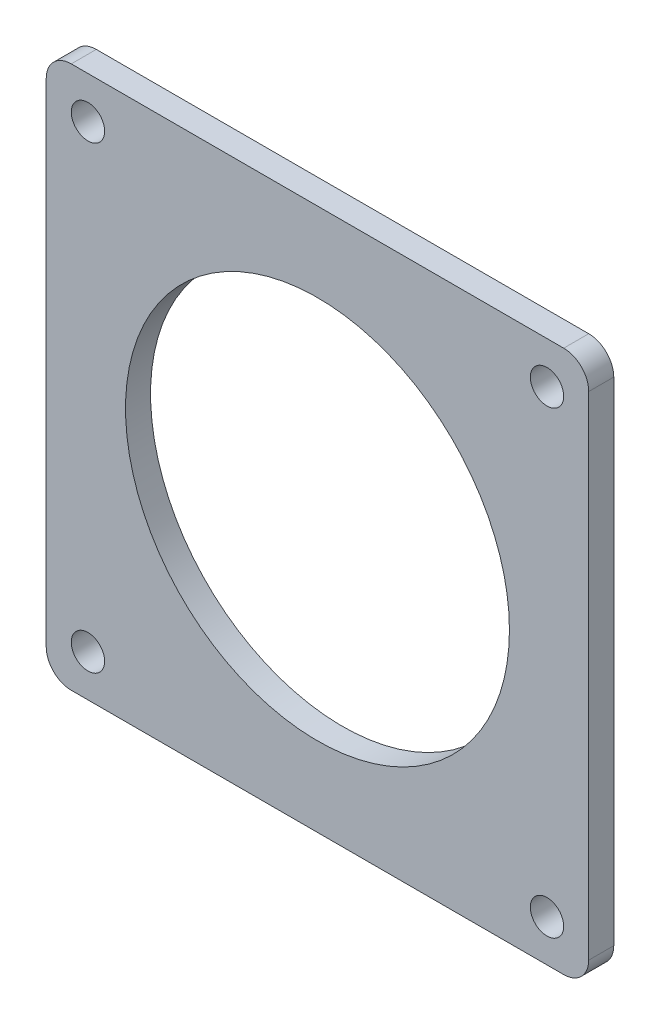
from build123d import *

# Parameters (mm, degrees)
SKETCH_1_W      = 65
SKETCH_1_H      = 65
SKETCH_1_R      = 2
SKETCH_1_R_2    = 23
EXTRUDE_1_DEPTH = 3
FILLET_1_R      = 3


with BuildPart() as part:
    # 草图1 → 凸台-拉伸1 (new body)
    with BuildSketch(Plane.XY):
        Rectangle(SKETCH_1_W, SKETCH_1_H)
        with Locations((-27.5, 27.5)):
            Circle(SKETCH_1_R, mode=Mode.SUBTRACT)
        with Locations((27.5, 27.5)):
            Circle(SKETCH_1_R, mode=Mode.SUBTRACT)
        with Locations((27.5, -27.5)):
            Circle(SKETCH_1_R, mode=Mode.SUBTRACT)
        with Locations((-27.5, -27.5)):
            Circle(SKETCH_1_R, mode=Mode.SUBTRACT)
        Circle(SKETCH_1_R_2, mode=Mode.SUBTRACT)
    extrude(amount=EXTRUDE_1_DEPTH)

    # 圆角1
    fillet_1_edges = [part.edges().sort_by_distance(p)[0] for p in [
        (32.5, -32.5, 1.5),
        (-32.5, -32.5, 1.5),
        (-32.5, 32.5, 1.5),
        (32.5, 32.5, 1.5),
    ]]
    fillet(fillet_1_edges, radius=FILLET_1_R)


solid = part.part
